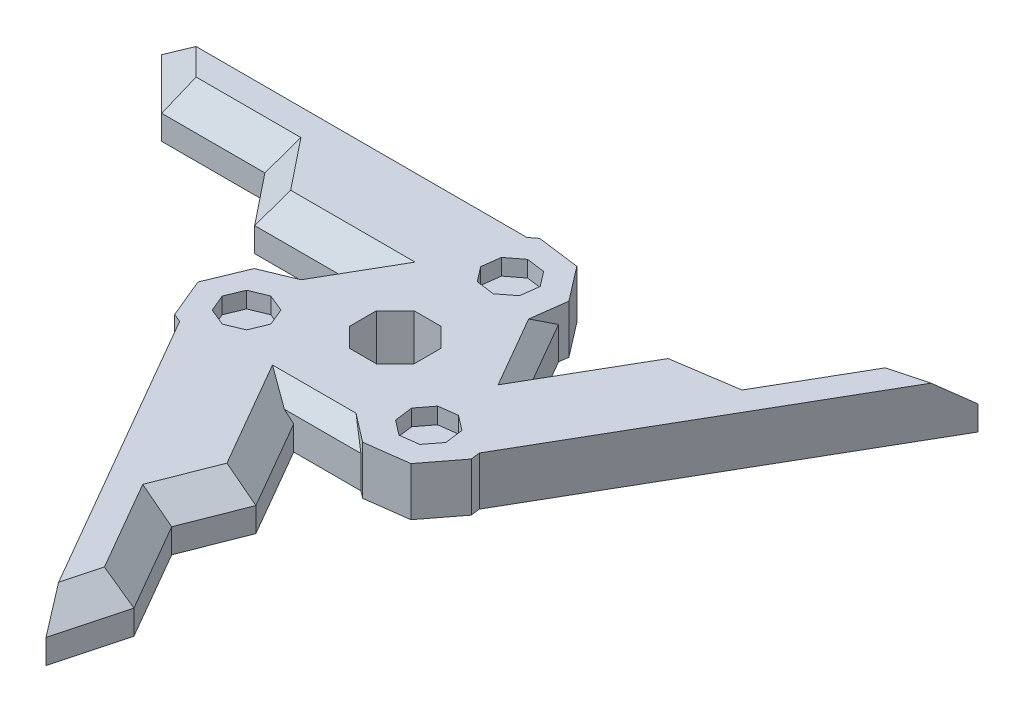
from build123d import *

# Parameters (mm, degrees)
BOSS_EXTRUDE2_DEPTH = 3
BOSS_EXTRUDE3_DEPTH = 3
CHAMFER1_SIZE       = 1.5
BOSS_EXTRUDE4_DEPTH = 3
CUT_EXTRUDE1_DEPTH  = 1
CHAMFER2_SIZE       = 1


with BuildPart() as part:
    # Sketch1 → Boss-Extrude2 (new body)
    with BuildSketch(Plane(origin=(0, 0, 0), x_dir=(1, 0, 0), z_dir=(0, 1, 0))):
        Polygon((-3.617228643129947, -6.5e-16), (-1.8086143215649655, -3.132611896247254), (1.8086143215649881, -3.132611896247241), (3.6172286431299465, 2.591e-14), (1.8086143215649435, 3.132611896247266), (-1.8086143215650103, 3.1326118962472274), align=None)
        Polygon((1.9999999999999936, 0.8284271247461886), (0.8284271247461865, 1.999999999999994), (-0.8284271247461888, 1.9999999999999927), (-1.9999999999999936, 0.8284271247461867), (-1.9999999999999922, -0.8284271247461881), (-0.8284271247461862, -1.9999999999999931), (0.8284271247461892, -1.9999999999999918), (1.999999999999994, -0.8284271247461859), align=None, mode=Mode.SUBTRACT)
    extrude(amount=BOSS_EXTRUDE2_DEPTH)

    # Sketch3 → Boss-Extrude3 (add)
    with BuildSketch(Plane(origin=(0, 0, 0), x_dir=(1, 0, 0), z_dir=(0, 1, 0))):
        Polygon((1.35009e-12, -6.265223792495006), (3.191385678434759, -11.792865934089827), (1.7284641960877252, -15.524235391675447), (4.912158247964482, -21.038555245281238), (3.7655427137404005, -25.31778267575289), (0.2655427137398905, -19.25560484926116), (-7.234457286261282, -6.2652237924924865), (-9.043071607825457, -3.132611896246603), (-7.234457286259898, 1.64471e-12), (-5.425842964695981, 3.1326118962470666), (-11.808614321563178, 3.132611896247083), (-14.30861432156403, 6.265223792494697), (-20.676002425317918, 6.265223792494897), (-23.80861432156554, 9.397835688742644), (-16.808614321564708, 9.397835688742767), (-1.8086143215623112, 9.397835688742738), (1.8086143215660542, 9.397835688742727), (3.6172286431313894, 6.265223792494598), (5.4258429646954855, 3.132611896248873), (8.617228643129225, 8.660254037843819), (12.58015012547734, 9.259011599181736), (15.763844177354214, 14.77333145278746), (20.043071607826096, 15.919946987011269), (16.54307160782585, 9.857769160519384), (9.04307160782462, -3.1326118962492617), (7.234457286260429, -6.265223792495135), (3.6172286431296587, -6.265223792494937), align=None)
        Polygon((-1.8086143215639572, -3.132611896247045), (-3.617228643129372, 9.8462e-13), (-1.808614321565077, 3.1326118962470595), (1.8086143215657584, 3.1326118962474574), (3.6172286431299985, 1.0129e-12), (1.8086143215649881, -3.132611896247241), align=None, mode=Mode.SUBTRACT)
    extrude(amount=BOSS_EXTRUDE3_DEPTH)

    # Chamfer1
    chamfer1_edges = [part.edges().sort_by_distance(p)[0] for p in [
        (17.903457892590154, 3, -15.346639219899364),
        (14.171997151415777, 3, -12.016171525984598),
        (10.598689384303283, 3, -8.959632818512777),
        (7.021535803912355, 3, -5.896432967046346),
        (-22.24230837344173, 3, -7.8315297406187705),
        (-17.492308373440974, 3, -6.2652237924947976),
        (-13.058614321563603, 3, -4.69891784437089),
        (-8.617228643129579, 3, -3.1326118962470746),
        (4.338850480852441, 3, 23.178168960517063),
        (3.3203112220261035, 3, 18.281395318478342),
        (2.459924937261242, 3, 13.658550662882636),
        (1.5956928392180545, 3, 9.029044863292416),
    ]]
    chamfer(chamfer1_edges, length=CHAMFER1_SIZE)

    # Sketch4 → Boss-Extrude4 (add)
    with BuildSketch(Plane(origin=(0, 0, 0), x_dir=(1, 0, 0), z_dir=(0, 1, 0))):
        Polygon((-6.798376917342761, -0.16876811390146088), (-6.798376917342759, -6.096455678591746), (-8.026041208745289, -5.587940479051664), (-9.043071607825457, -3.132611896246603), (-8.026041208745289, -0.6772833134415445), align=None)
        Polygon((3.4264760493730018, 7.289397235314943), (1.8086143215658708, 9.39783568874193), (-0.8262778053214378, 9.744725818120022), (-1.8804970320349317, 8.935794954216455), (3.2530309846839565, 5.97195117187129), align=None)
        Polygon((4.59956515937226, -6.612113921873456), (7.23445728625957, -6.2652237924954015), (8.852319014066733, -4.156785339068437), (8.678873949377703, -2.8393392756247793), (3.545345932658778, -5.803183057969877), align=None)
    extrude(amount=BOSS_EXTRUDE4_DEPTH)

    # Sketch6 → Cut-Extrude1 (cut)
    with BuildSketch(Plane(origin=(0, 3, 0), x_dir=(1, 0, 0), z_dir=(0, 1, 0))):
        Polygon((1.058614321565864, 8.098797583065272), (-0.07961424608791523, 8.248648216822222), (-0.9904237841107939, 7.549759477388622), (-1.1402744178677426, 6.411530909734845), (-0.4413856784341425, 5.500721371711964), (0.6968428892196359, 5.350870737955016), (1.6076524272425143, 6.049759477388614), (1.757503060999463, 7.187988045042393), align=None)
        Polygon((-7.543071607825456, -3.1326118962466047), (-7.103731779605277, -4.193272068026425), (-6.043071607825456, -4.632611896246601), (-4.982411436045638, -4.193272068026424), (-4.5430716078254605, -3.1326118962466007), (-4.982411436045639, -2.071951724466782), (-6.043071607825459, -1.6326118962466047), (-7.103731779605278, -2.0719517244667833), align=None)
        Polygon((6.484457286259583, -4.966185686818733), (7.183346025693192, -4.0553761487958635), (7.033495391936258, -2.9171475811420824), (6.122685853913389, -2.218258841708473), (4.984457286259606, -2.368109475465409), (4.2855685468259965, -3.2789190134882777), (4.435419180582931, -4.417147581142059), (5.346228718605801, -5.116036320575668), align=None)
    extrude(amount=-CUT_EXTRUDE1_DEPTH, mode=Mode.SUBTRACT)

    # Chamfer2
    chamfer2_edges = [part.edges().sort_by_distance(p)[0] for p in [
        (1.2077191668051772, 3, 6.265223792494805),
        (4.821983381293134, 3, -4.1785273753389465),
        (-6.029702548098242, 3, -2.0866964171569644),
    ]]
    chamfer(chamfer2_edges, length=CHAMFER2_SIZE)


solid = part.part
